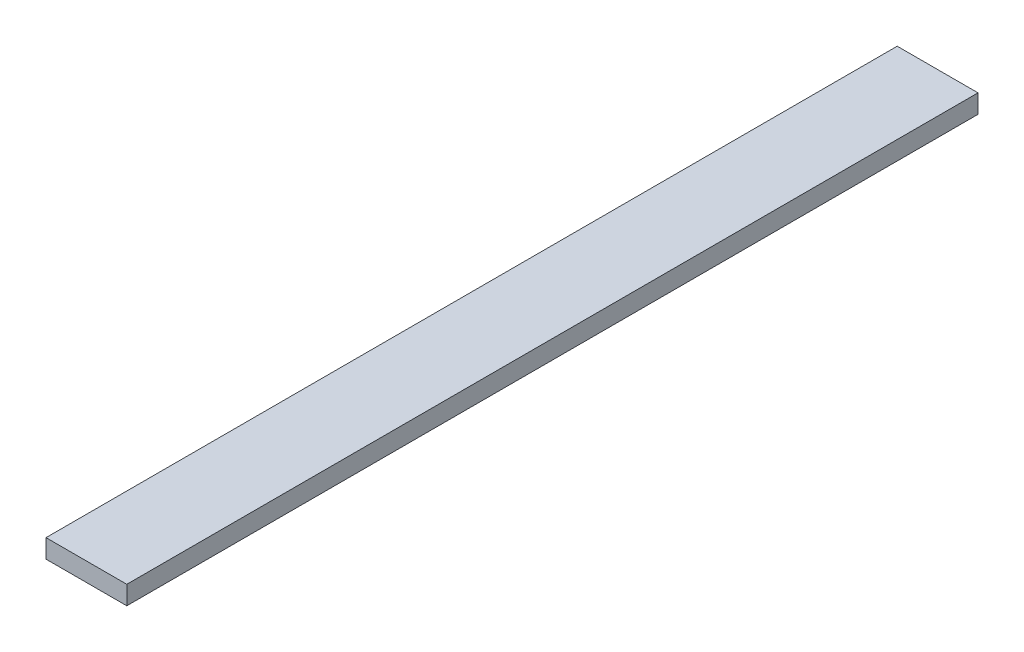
from build123d import *

# Parameters (mm, degrees)
SKETCH1_W           = 41.275
SKETCH1_H           = 9.525
BOSS_EXTRUDE1_DEPTH = 434.848


with BuildPart() as part:
    # Sketch1 → Boss-Extrude1 (new body)
    with BuildSketch(Plane.XY):
        with Locations((20.6375, 4.7625)):
            Rectangle(SKETCH1_W, SKETCH1_H)
    extrude(amount=BOSS_EXTRUDE1_DEPTH)


solid = part.part
